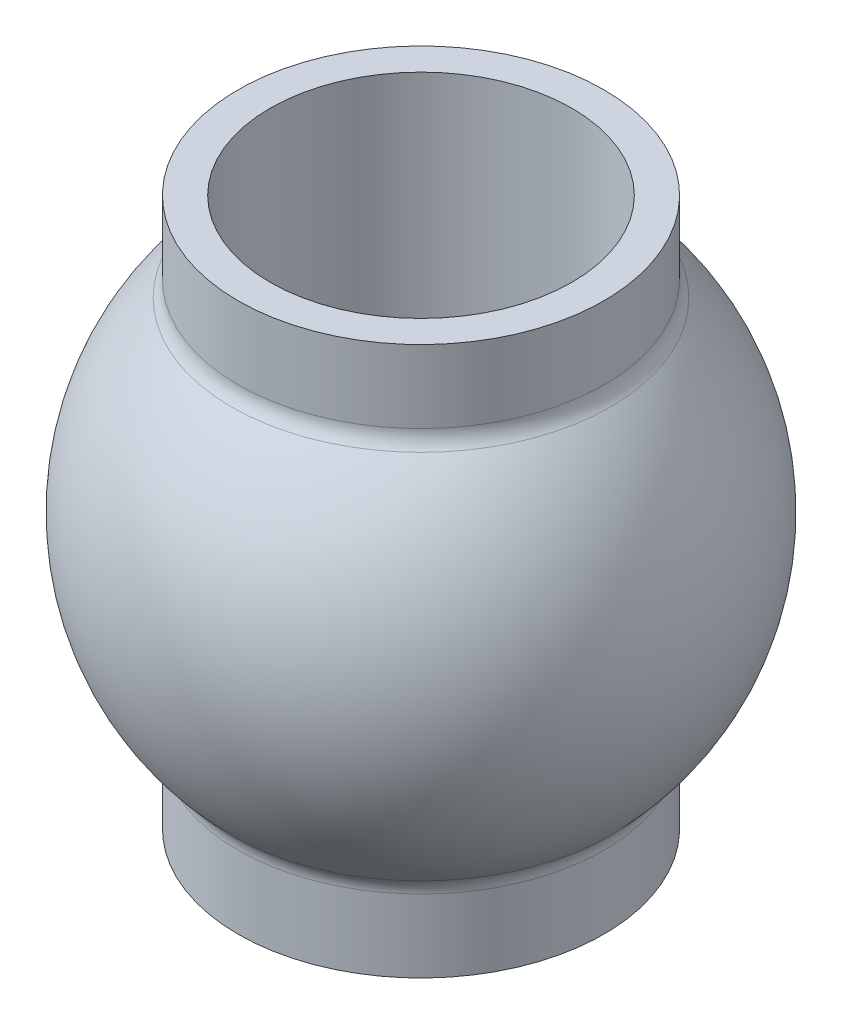
from build123d import *

# Parameters (mm, degrees)
SKETCH2_R          = 1.65
CUT_EXTRUDE1_DEPTH = 6
FILLET1_R          = 0.25


with BuildPart() as part:
    # Sketch1 → Revolve1 (revolve)
    with BuildSketch(Plane.XY, mode=Mode.PRIVATE) as revolve1_sk:
        with BuildLine():
            Line((0, 3), (2, 3))
            Line((2, 3), (2, 2.1))
            ThreePointArc((2, 2.1), (2.9, 0), (2, -2.1))
            Line((2, -2.1), (2, -3))
            Line((2, -3), (0, -3))
            Line((0, -3), (0, 3))
        make_face()
    revolve(revolve1_sk.sketch.rotate(Axis((0, 4.183554313, 0), (0, -1, 0)), 90), axis=Axis((0, 4.183554313, 0), (0, -1, 0)))

    # Sketch2 → Cut-Extrude1 (cut)
    with BuildSketch(Plane(origin=(0, 3, 0), x_dir=(1, 0, 0), z_dir=(0, 1, 0))):
        with Locations(Location((0, 0, 0), (0, 0, 270))):
            Circle(SKETCH2_R)
    extrude(amount=-CUT_EXTRUDE1_DEPTH, mode=Mode.SUBTRACT)

    # Fillet1
    fillet1_edges = [part.edges().sort_by_distance(p)[0] for p in [
        (0, -2.1, -2),
        (0, 2.1, -2),
    ]]
    fillet(fillet1_edges, radius=FILLET1_R)


solid = part.part
